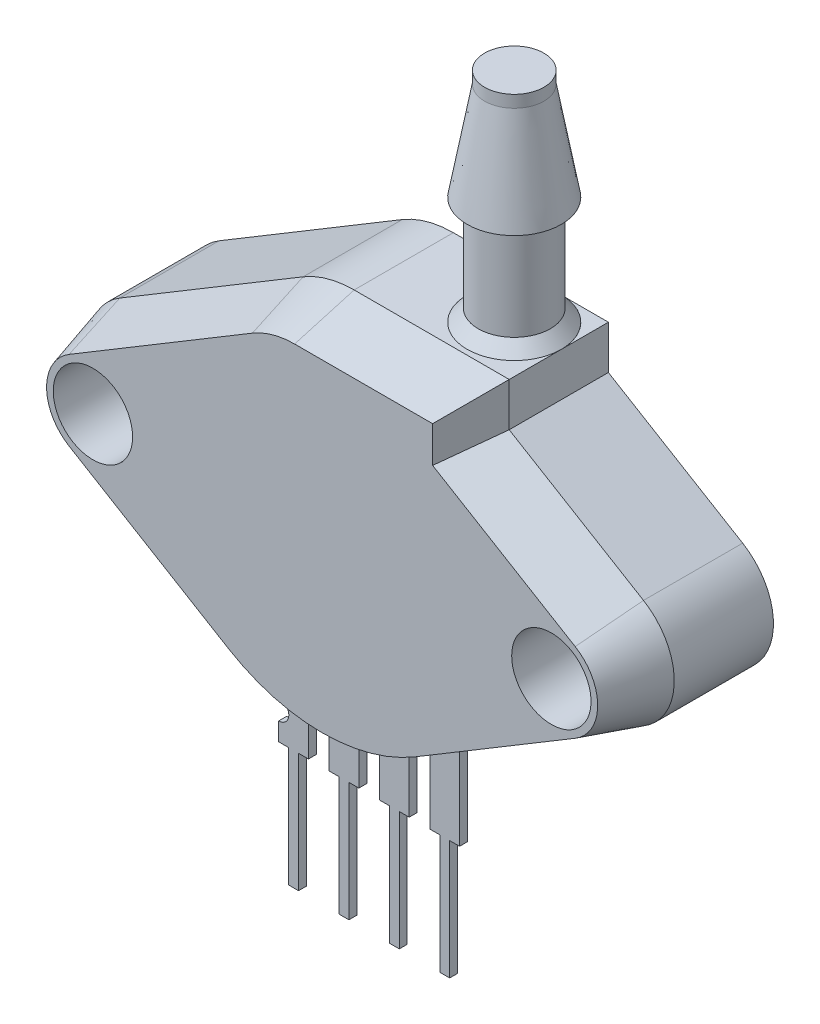
from build123d import *
from OCP.BRepFilletAPI import BRepFilletAPI_MakeChamfer

# Parameters (mm, degrees)
SKIZZE1_R                       = 2
AUFSATZ_LINEAR_AUSTRAGEN1_DEPTH = 8
SKIZZE2_R                       = 2.375
AUFSATZ_LINEAR_AUSTRAGEN2_DEPTH = 11
FASE1_SIZE                      = 3
FASE1_SIZE2                     = 0.860236157
AUFSATZ_LINEAR_AUSTRAGEN3_DEPTH = 0.4
SKIZZE5_R                       = 0.509593562
SCHNITT_LINEAR_AUSTRAGEN1_DEPTH = 26.48056909


with BuildPart() as part:
    # Skizze1 → Aufsatz-Linear austragen1 (new body)
    with BuildSketch(Plane.XY):
        with BuildLine():
            Line((-13.199545584, 2.739250778), (-3.959262527, 8.28677743))
            ThreePointArc((-3.959262527, 8.28677743), (-2.720950124, 8.81839637), (-1.385638765, 9))
            Line((-1.385638765, 9), (0, 9))
            Line((0, 9), (2.77127753, 9))
            Line((2.77127753, 9), (6.43, 9))
            Line((6.43, 9), (6.43, 6.803437374))
            Line((6.43, 6.803437374), (13.199545584, 2.739250778))
            ThreePointArc((13.199545584, 2.739250778), (14.75, 0), (13.199545584, -2.739250778))
            Line((13.199545584, -2.739250778), (5.147247524, -7.573554859))
            ThreePointArc((5.147247524, -7.573554859), (0, -9), (-5.147247524, -7.573554859))
            Line((-5.147247524, -7.573554859), (-13.199545584, -2.739250778))
            ThreePointArc((-13.199545584, -2.739250778), (-14.75, 0), (-13.199545584, 2.739250778))
        make_face()
        with Locations((-11.555, 0)):
            Circle(SKIZZE1_R, mode=Mode.SUBTRACT)
        with Locations(Location((11.555, 0, 0), (0, 0, 180))):
            Circle(SKIZZE1_R, mode=Mode.SUBTRACT)
    extrude(amount=AUFSATZ_LINEAR_AUSTRAGEN1_DEPTH)

    # Skizze2 → Aufsatz-Linear austragen2 (add)
    with BuildSketch(Plane(origin=(0, 9, 0), x_dir=(1, 0, 0), z_dir=(0, 1, 0))):
        with Locations(Location((4.055, -2.375, 0), (0, 0, 90))):
            Circle(SKIZZE2_R)
    extrude(amount=AUFSATZ_LINEAR_AUSTRAGEN2_DEPTH)

    # Skizze3 → Schnitt-Rotation5 (revolve, cut)
    with BuildSketch(Plane(origin=(0, 0, 2.37), x_dir=(-1, 0, 0), z_dir=(0, 0, -1)), mode=Mode.PRIVATE) as schnitt_rotation5_sk:
        Polygon((-5.548619779, 20), (-5.548619779, 19.390425007), (-6.43, 14.45438156), (-5.871186885, 14.45438156), (-5.871186885, 9.618429672), (-6.43, 9), (-7.295904823, 9), (-6.993468517, 15.795841506), (-6.993468517, 20), align=None)
    revolve(schnitt_rotation5_sk.sketch.rotate(Axis((4.055, 22.337602527, 2.37), (0, -1, 0)), 0.060311358), axis=Axis((4.055, 22.337602527, 2.37), (0, -1, 0)), mode=Mode.SUBTRACT)

    # Fase1: one chamfer whose edges measure the first distance from different faces: ONE call of the kernel's chamfer builder (chamfer() names one face for all edges)
    fase1_edges_1 = [part.edges().sort_by_distance(p)[0] for p in [
        (14.75, 0, 8),
    ]]
    fase1_side_1 = [part.faces().sort_by_distance(p)[0] for p in [
        (14.75, 0, 4),
    ]]
    fase1_edges_2 = [part.edges().sort_by_distance(p)[0] for p in [
        (9.814772792, 4.771344076, 8),
    ]]
    fase1_side_2 = [part.faces().sort_by_distance(p)[0] for p in [
        (9.814772792, 4.771344076, 4),
    ]]
    fase1_edges_3 = [part.edges().sort_by_distance(p)[0] for p in [
        (6.43, 7.901718687, 8),
    ]]
    fase1_side_3 = [part.faces().sort_by_distance(p)[0] for p in [
        (6.43, 7.901718687, 4),
    ]]
    fase1_edges_4 = [part.edges().sort_by_distance(p)[0] for p in [
        (2.522180617, 9, 8),
    ]]
    fase1_side_4 = [part.faces().sort_by_distance(p)[0] for p in [
        (1.917072159, 9, 4.642485362),
    ]]
    fase1_edges_5 = [part.edges().sort_by_distance(p)[0] for p in [
        (-2.720950124, 8.81839637, 8),
    ]]
    fase1_side_5 = [part.faces().sort_by_distance(p)[0] for p in [
        (-2.720950124, 8.81839637, 4),
    ]]
    fase1_edges_6 = [part.edges().sort_by_distance(p)[0] for p in [
        (-8.579404056, 5.513014104, 8),
    ]]
    fase1_side_6 = [part.faces().sort_by_distance(p)[0] for p in [
        (-8.579404056, 5.513014104, 4),
    ]]
    fase1_edges_7 = [part.edges().sort_by_distance(p)[0] for p in [
        (-14.75, 0, 8),
    ]]
    fase1_side_7 = [part.faces().sort_by_distance(p)[0] for p in [
        (-14.75, 0, 4),
    ]]
    fase1_edges_8 = [part.edges().sort_by_distance(p)[0] for p in [
        (-9.173396554, -5.156402818, 8),
    ]]
    fase1_side_8 = [part.faces().sort_by_distance(p)[0] for p in [
        (-9.173396554, -5.156402818, 4),
    ]]
    fase1_edges_9 = [part.edges().sort_by_distance(p)[0] for p in [
        (0, -9, 8),
    ]]
    fase1_side_9 = [part.faces().sort_by_distance(p)[0] for p in [
        (0, -9, 4),
    ]]
    fase1_edges_10 = [part.edges().sort_by_distance(p)[0] for p in [
        (9.173396554, -5.156402818, 8),
    ]]
    fase1_side_10 = [part.faces().sort_by_distance(p)[0] for p in [
        (9.173396554, -5.156402818, 4),
    ]]
    fase1 = BRepFilletAPI_MakeChamfer(part.part.solid().wrapped)
    for e in fase1_edges_1:
        fase1.Add(FASE1_SIZE, FASE1_SIZE2, e.wrapped, fase1_side_1[0].wrapped)  # the first distance lies on this face
    for e in fase1_edges_2:
        fase1.Add(FASE1_SIZE, FASE1_SIZE2, e.wrapped, fase1_side_2[0].wrapped)  # the first distance lies on this face
    for e in fase1_edges_3:
        fase1.Add(FASE1_SIZE, FASE1_SIZE2, e.wrapped, fase1_side_3[0].wrapped)  # the first distance lies on this face
    for e in fase1_edges_4:
        fase1.Add(FASE1_SIZE, FASE1_SIZE2, e.wrapped, fase1_side_4[0].wrapped)  # the first distance lies on this face
    for e in fase1_edges_5:
        fase1.Add(FASE1_SIZE, FASE1_SIZE2, e.wrapped, fase1_side_5[0].wrapped)  # the first distance lies on this face
    for e in fase1_edges_6:
        fase1.Add(FASE1_SIZE, FASE1_SIZE2, e.wrapped, fase1_side_6[0].wrapped)  # the first distance lies on this face
    for e in fase1_edges_7:
        fase1.Add(FASE1_SIZE, FASE1_SIZE2, e.wrapped, fase1_side_7[0].wrapped)  # the first distance lies on this face
    for e in fase1_edges_8:
        fase1.Add(FASE1_SIZE, FASE1_SIZE2, e.wrapped, fase1_side_8[0].wrapped)  # the first distance lies on this face
    for e in fase1_edges_9:
        fase1.Add(FASE1_SIZE, FASE1_SIZE2, e.wrapped, fase1_side_9[0].wrapped)  # the first distance lies on this face
    for e in fase1_edges_10:
        fase1.Add(FASE1_SIZE, FASE1_SIZE2, e.wrapped, fase1_side_10[0].wrapped)  # the first distance lies on this face
    add(Compound.cast(fase1.Shape()), mode=Mode.REPLACE)

    # Skizze4 → Aufsatz-Linear austragen3 (add)
    with BuildSketch(Plane.XY.offset(5.63)):
        Polygon((-1.52, -12), (-2.02, -12), (-2.02, -5), (-0.52, -5), (-0.52, -12), (-1.02, -12), (-1.02, -18), (-1.52, -18), align=None)
        Polygon((-4.06, -12), (-4.56, -12), (-4.56, -5), (-3.06, -5), (-3.06, -12), (-3.56, -12), (-3.56, -18), (-4.06, -18), align=None)
        Polygon((3.56, -12), (3.56, -18), (4.06, -18), (4.06, -12), (4.56, -12), (4.56, -5), (3.06, -5), (3.06, -12), align=None)
        Polygon((1.02, -12), (1.02, -18), (1.52, -18), (1.52, -12), (2.02, -12), (2.02, -5), (0.52, -5), (0.52, -12), align=None)
    extrude(amount=-AUFSATZ_LINEAR_AUSTRAGEN3_DEPTH)

    # Skizze5 → Schnitt-Linear austragen1 (cut, through all)
    with BuildSketch(Plane.XY.offset(5.63)):
        with Locations((-4.56, -10.577193371)):
            Circle(SKIZZE5_R)
    extrude(amount=-SCHNITT_LINEAR_AUSTRAGEN1_DEPTH, mode=Mode.SUBTRACT)


solid = part.part
